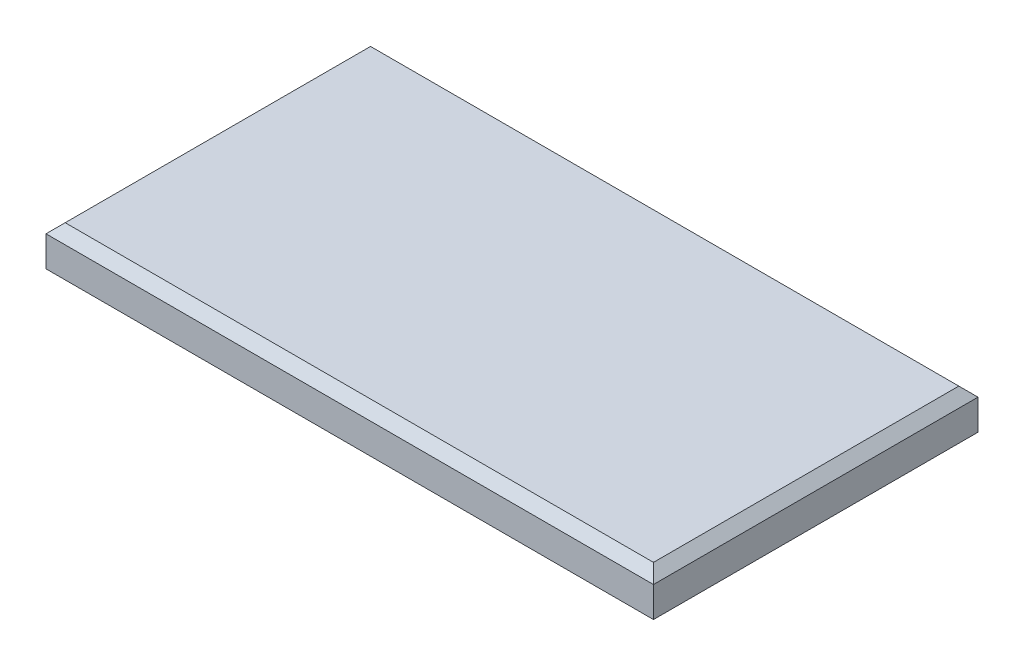
from build123d import *

# Parameters (mm, degrees)
SKETCH1_W           = 380
SKETCH1_H           = 203
BOSS_EXTRUDE1_DEPTH = 25
CHAMFER1_SIZE       = 6


with BuildPart() as part:
    # Sketch1 → Boss-Extrude1 (new body)
    with BuildSketch(Plane(origin=(0, 0, 0), x_dir=(1, 0, 0), z_dir=(0, 1, 0))):
        Rectangle(SKETCH1_W, SKETCH1_H)
    extrude(amount=BOSS_EXTRUDE1_DEPTH)

    # Chamfer1
    chamfer1_edges = [part.edges().sort_by_distance(p)[0] for p in [
        (190, 25, 0),
        (0, 25, -101.5),
        (-190, 25, 0),
        (0, 25, 101.5),
    ]]
    chamfer(chamfer1_edges, length=CHAMFER1_SIZE)


solid = part.part
